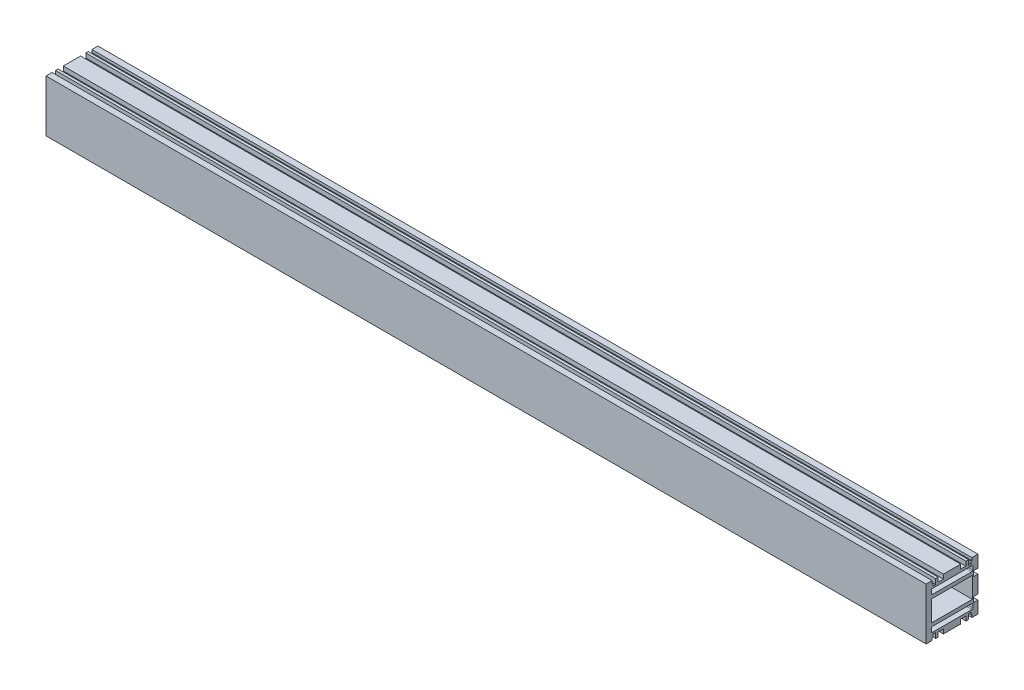
from build123d import *

# Parameters (mm, degrees)
SKETCH_1_W             = 23.5
SKETCH_1_H             = 12
EXTRUDE_1_DEPTH        = 254.5
HOLE_WIZARD_M6_1_D     = 5
HOLE_WIZARD_M6_1_DEPTH = 19
HOLE_WIZARD_M6_1_TIP   = 1.502151548
HOLE_WIZARD_M6_2_D     = 5
HOLE_WIZARD_M6_2_DEPTH = 19
HOLE_WIZARD_M6_2_TIP   = 1.502151548
HOLE_WIZARD_M4_1_D     = 3.3
HOLE_WIZARD_M4_1_DEPTH = 11.5
HOLE_WIZARD_M4_1_TIP   = 0.991420021


with BuildPart() as part:
    # 草图1 → 凸台-拉伸1 (new, symmetric)
    with BuildSketch(Plane(origin=(0, 0, 0), x_dir=(0, 0, -1), z_dir=(1, 0, 0))):
        Polygon((-15, 15), (-11.5, 15), (-11.5, 13.5), (-11, 13.5), (-11, 12), (-9.5, 12), (-9.5, 15), (-8, 15), (-8, 12.5), (-5, 12.5), (-5, 15), (5, 15), (5, 12.5), (8, 12.5), (8, 15), (9.5, 15), (9.5, 12), (11, 12), (11, 13.5), (11.5, 13.5), (11.5, 15), (15, 15), (15, 8), (12.5, 8), (12.5, 5), (15, 5), (15, -5), (12.5, -5), (12.5, -8), (15, -8), (15, -15), (11.5, -15), (11.5, -13.5), (11, -13.5), (11, -12), (9.5, -12), (9.5, -15), (8, -15), (8, -12.5), (5, -12.5), (5, -15), (-5, -15), (-5, -12.5), (-8, -12.5), (-8, -15), (-9.5, -15), (-9.5, -12), (-11, -12), (-11, -13.5), (-11.5, -13.5), (-11.5, -15), (-15, -15), align=None)
        with BuildLine():
            Line((12, -10.5), (12, -8.5))
            ThreePointArc((12, -8.5), (11.853553391, -8.146446609), (11.5, -8))
            Line((11.5, -8), (-11.5, -8))
            ThreePointArc((-11.5, -8), (-11.853553391, -8.146446609), (-12, -8.5))
            Line((-12, -8.5), (-12, -10.5))
            ThreePointArc((-12, -10.5), (-11.853553391, -10.853553391), (-11.5, -11))
            Line((-11.5, -11), (11.5, -11))
            ThreePointArc((11.5, -11), (11.853553391, -10.853553391), (12, -10.5))
        make_face(mode=Mode.SUBTRACT)
        with BuildLine():
            Line((-11.5, 11), (11.5, 11))
            ThreePointArc((11.5, 11), (11.853553391, 10.853553391), (12, 10.5))
            Line((12, 10.5), (12, 8.5))
            ThreePointArc((12, 8.5), (11.853553391, 8.146446609), (11.5, 8))
            Line((11.5, 8), (-11.5, 8))
            ThreePointArc((-11.5, 8), (-11.853553391, 8.146446609), (-12, 8.5))
            Line((-12, 8.5), (-12, 10.5))
            ThreePointArc((-12, 10.5), (-11.853553391, 10.853553391), (-11.5, 11))
        make_face(mode=Mode.SUBTRACT)
        Rectangle(SKETCH_1_W, SKETCH_1_H, mode=Mode.SUBTRACT)
    extrude(amount=EXTRUDE_1_DEPTH, both=True)

    # M6 螺纹孔1
    with Locations(Plane(origin=(0, 0, -15), x_dir=(-1, 0, 0), z_dir=(0, 0, -1))):
        with Locations((16.5, 0), (1.5, 0), (-219.5, 0), (-234.5, 0)):
            Hole(HOLE_WIZARD_M6_1_D / 2, depth=HOLE_WIZARD_M6_1_DEPTH)
            with Locations((0, 0, -(HOLE_WIZARD_M6_1_DEPTH + HOLE_WIZARD_M6_1_TIP / 2))):  # 118° drill point
                Cone(0, HOLE_WIZARD_M6_1_D / 2, HOLE_WIZARD_M6_1_TIP, mode=Mode.SUBTRACT)

    # M6 螺纹孔2
    with Locations(Plane(origin=(0, -15, 0), x_dir=(-1, 0, 0), z_dir=(0, -1, 0))):
        with Locations((-219.5, 0), (-234.5, 0), (234.5, 0), (219.5, 0)):
            Hole(HOLE_WIZARD_M6_2_D / 2, depth=HOLE_WIZARD_M6_2_DEPTH)
            with Locations((0, 0, -(HOLE_WIZARD_M6_2_DEPTH + HOLE_WIZARD_M6_2_TIP / 2))):  # 118° drill point
                Cone(0, HOLE_WIZARD_M6_2_D / 2, HOLE_WIZARD_M6_2_TIP, mode=Mode.SUBTRACT)

    # M4 螺纹孔1
    with Locations(Plane(origin=(0, -15, 0), x_dir=(-1, 0, 0), z_dir=(0, -1, 0))):
        with Locations((-131, 0), (51.5, 0)):
            Hole(HOLE_WIZARD_M4_1_D / 2, depth=HOLE_WIZARD_M4_1_DEPTH)
            with Locations((0, 0, -(HOLE_WIZARD_M4_1_DEPTH + HOLE_WIZARD_M4_1_TIP / 2))):  # 118° drill point
                Cone(0, HOLE_WIZARD_M4_1_D / 2, HOLE_WIZARD_M4_1_TIP, mode=Mode.SUBTRACT)


solid = part.part
